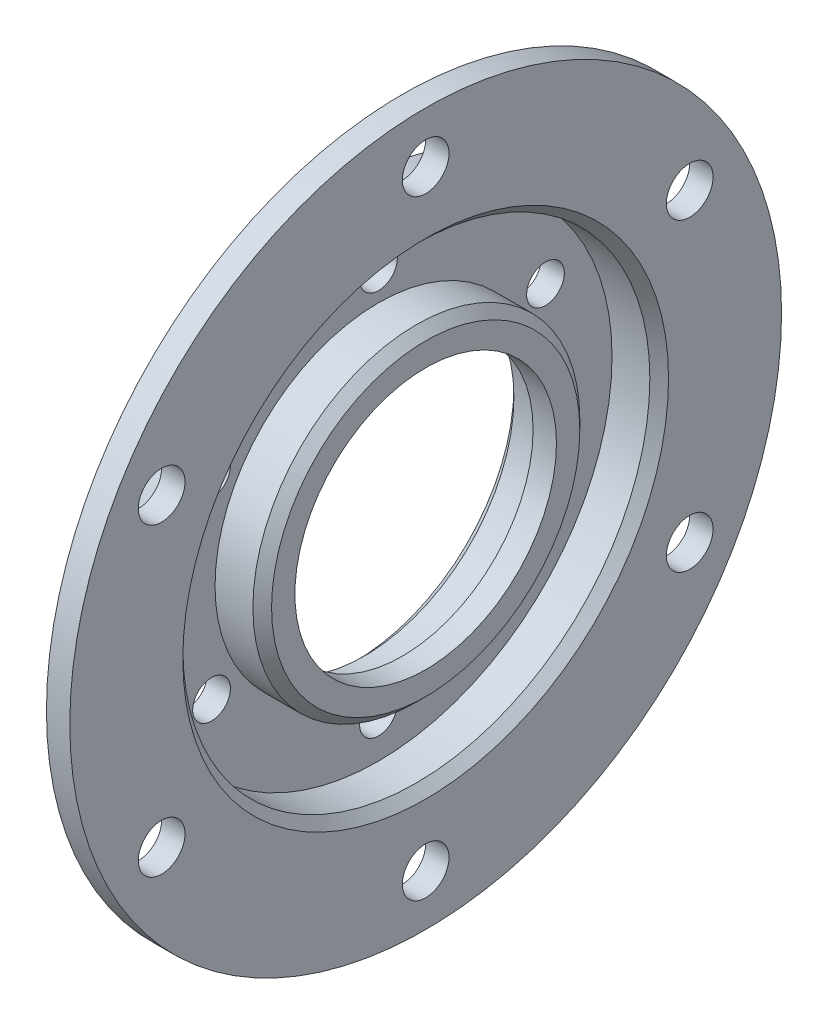
from build123d import *

# Parameters (mm, degrees)
SKETCH1_R           = 27.5
SKETCH1_R_2         = 2.0193
SKETCH1_R_3         = 16
BOSS_EXTRUDE1_DEPTH = 5.05
SKETCH2_R           = 38.1
SKETCH2_R_2         = 2.0193
SKETCH2_R_3         = 14
SKETCH2_R_4         = 2.5
BOSS_EXTRUDE2_DEPTH = 2.5
SKETCH3_R           = 25
SKETCH3_R_2         = 17.5
CUT_EXTRUDE1_DEPTH  = 5.05
CHAMFER1_SIZE       = 1


with BuildPart() as part:
    # Sketch1 → Boss-Extrude1 (new body)
    with BuildSketch(Plane(origin=(0, 0, 0), x_dir=(0, 0, -1), z_dir=(1, 0, 0))):
        Circle(SKETCH1_R)
        with Locations((0, 20.64)):
            Circle(SKETCH1_R_2, mode=Mode.SUBTRACT)
        with Locations((17.874764334, 10.32)):
            Circle(SKETCH1_R_2, mode=Mode.SUBTRACT)
        with Locations((17.874764334, -10.32)):
            Circle(SKETCH1_R_2, mode=Mode.SUBTRACT)
        with Locations((0, -20.64)):
            Circle(SKETCH1_R_2, mode=Mode.SUBTRACT)
        with Locations((-17.874764334, -10.32)):
            Circle(SKETCH1_R_2, mode=Mode.SUBTRACT)
        with Locations((-17.874764334, 10.32)):
            Circle(SKETCH1_R_2, mode=Mode.SUBTRACT)
        Circle(SKETCH1_R_3, mode=Mode.SUBTRACT)
    extrude(amount=BOSS_EXTRUDE1_DEPTH)

    # Sketch2 → Boss-Extrude2 (add)
    with BuildSketch(Plane(origin=(5.05, 0, 0), x_dir=(0, 0, -1), z_dir=(1, 0, 0))):
        Circle(SKETCH2_R)
        with Locations((0, 20.64)):
            Circle(SKETCH2_R_2, mode=Mode.SUBTRACT)
        Circle(SKETCH2_R_3, mode=Mode.SUBTRACT)
        with Locations((17.874764334, 10.32)):
            Circle(SKETCH2_R_2, mode=Mode.SUBTRACT)
        with Locations((17.874764334, -10.32)):
            Circle(SKETCH2_R_2, mode=Mode.SUBTRACT)
        with Locations((0, -20.64)):
            Circle(SKETCH2_R_2, mode=Mode.SUBTRACT)
        with Locations((-17.874764334, -10.32)):
            Circle(SKETCH2_R_2, mode=Mode.SUBTRACT)
        with Locations((-17.874764334, 10.32)):
            Circle(SKETCH2_R_2, mode=Mode.SUBTRACT)
        with Locations((0, 32.64)):
            Circle(SKETCH2_R_4, mode=Mode.SUBTRACT)
        with Locations((28.26706918, 16.32)):
            Circle(SKETCH2_R_4, mode=Mode.SUBTRACT)
        with Locations((28.26706918, -16.32)):
            Circle(SKETCH2_R_4, mode=Mode.SUBTRACT)
        with Locations((0, -32.64)):
            Circle(SKETCH2_R_4, mode=Mode.SUBTRACT)
        with Locations((-28.26706918, -16.32)):
            Circle(SKETCH2_R_4, mode=Mode.SUBTRACT)
        with Locations((-28.26706918, 16.32)):
            Circle(SKETCH2_R_4, mode=Mode.SUBTRACT)
    extrude(amount=BOSS_EXTRUDE2_DEPTH)

    # Sketch3 → Cut-Extrude1 (cut)
    with BuildSketch(Plane(origin=(7.55, 0, 0), x_dir=(0, 0, -1), z_dir=(1, 0, 0))):
        Circle(SKETCH3_R)
        Circle(SKETCH3_R_2, mode=Mode.SUBTRACT)
    extrude(amount=-CUT_EXTRUDE1_DEPTH, mode=Mode.SUBTRACT)

    # Chamfer1
    chamfer1_edges = [part.edges().sort_by_distance(p)[0] for p in [
        (5.05, 0, 27.5),
        (7.55, 0, 25),
        (7.55, 0, 17.5),
        (0, 0, 16),
    ]]
    chamfer(chamfer1_edges, length=CHAMFER1_SIZE)


solid = part.part
